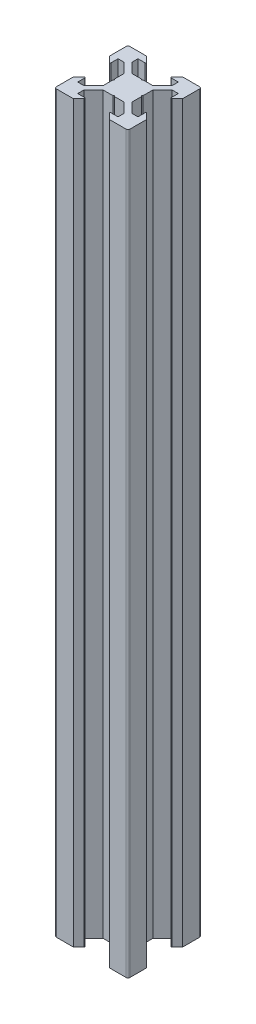
from build123d import *

# Parameters (mm, degrees)
BOSS_EXTRUDE1_DEPTH = 200


with BuildPart() as part:
    # Sketch1 → Boss-Extrude1 (new body)
    with BuildSketch(Plane(origin=(0, 0, 0), x_dir=(1, 0, 0), z_dir=(0, 1, 0))):
        with BuildLine():
            Line((-0.266657426, -3.932437418), (-0.066657426, -3.732437418))
            Line((-0.066657426, -3.732437418), (0.133342575, -3.932437418))
            Line((0.133342575, -3.932437418), (2.773342575, -3.932437418))
            Line((2.773342575, -3.932437418), (5.422682403, -6.581777247))
            Line((5.422682403, -6.581777247), (5.422682403, -8.231777247))
            Line((5.422682403, -8.231777247), (3.516185287, -8.231777247))
            ThreePointArc((3.516185287, -8.231777247), (3.331409381, -8.35524056), (3.37476393, -8.573198602))
            Line((3.37476393, -8.573198602), (4.833342574, -10.031777246))
            Line((4.833342574, -10.031777246), (9.433342574, -10.031777246))
            ThreePointArc((9.433342574, -10.031777246), (9.786895965, -9.885330637), (9.933342574, -9.531777246))
            Line((9.933342574, -9.531777246), (9.933342574, -4.931777246))
            Line((9.933342574, -4.931777246), (8.474763931, -3.473198602))
            ThreePointArc((8.474763931, -3.473198602), (8.256805888, -3.429844053), (8.133342575, -3.614619959))
            Line((8.133342575, -3.614619959), (8.133342575, -5.521117075))
            Line((8.133342575, -5.521117075), (6.483342575, -5.521117075))
            Line((6.483342575, -5.521117075), (3.834002746, -2.871777247))
            Line((3.834002746, -2.871777247), (3.834002746, -0.231777247))
            Line((3.834002746, -0.231777247), (3.634002746, -0.031777246))
            Line((3.634002746, -0.031777246), (3.834002746, 0.168222754))
            Line((3.834002746, 0.168222754), (3.834002746, 2.808222754))
            Line((3.834002746, 2.808222754), (6.483342575, 5.457562582))
            Line((6.483342575, 5.457562582), (8.133342575, 5.457562582))
            Line((8.133342575, 5.457562582), (8.133342575, 3.551065466))
            ThreePointArc((8.133342575, 3.551065466), (8.256805888, 3.36628956), (8.474763931, 3.40964411))
            Line((8.474763931, 3.40964411), (9.933342575, 4.868222753))
            Line((9.933342575, 4.868222753), (9.933342575, 9.468222753))
            ThreePointArc((9.933342575, 9.468222753), (9.786895965, 9.821776143), (9.433342575, 9.968222753))
            Line((9.433342575, 9.968222753), (4.833342575, 9.968222753))
            Line((4.833342575, 9.968222753), (3.374763931, 8.50964411))
            ThreePointArc((3.374763931, 8.50964411), (3.331409381, 8.291686067), (3.516185287, 8.168222754))
            Line((3.516185287, 8.168222754), (5.422682403, 8.168222754))
            Line((5.422682403, 8.168222754), (5.422682403, 6.518222754))
            Line((5.422682403, 6.518222754), (2.773342575, 3.868882925))
            Line((2.773342575, 3.868882925), (0.133342575, 3.868882925))
            Line((0.133342575, 3.868882925), (-0.066657426, 3.668882925))
            Line((-0.066657426, 3.668882925), (-0.266657426, 3.868882925))
            Line((-0.266657426, 3.868882925), (-2.906657426, 3.868882925))
            Line((-2.906657426, 3.868882925), (-5.555997254, 6.518222754))
            Line((-5.555997254, 6.518222754), (-5.555997254, 8.168222754))
            Line((-5.555997254, 8.168222754), (-3.649500138, 8.168222754))
            ThreePointArc((-3.649500138, 8.168222754), (-3.464724232, 8.291686067), (-3.508078782, 8.50964411))
            Line((-3.508078782, 8.50964411), (-4.966657426, 9.968222754))
            Line((-4.966657426, 9.968222754), (-9.566657426, 9.968222754))
            ThreePointArc((-9.566657426, 9.968222754), (-9.920210817, 9.821776144), (-10.066657426, 9.468222753))
            Line((-10.066657426, 9.468222753), (-10.066657426, 4.868222753))
            Line((-10.066657426, 4.868222753), (-8.608078782, 3.40964411))
            ThreePointArc((-8.608078782, 3.40964411), (-8.39012074, 3.366289559), (-8.266657426, 3.551065466))
            Line((-8.266657426, 3.551065466), (-8.266657426, 5.457562582))
            Line((-8.266657426, 5.457562582), (-6.616657426, 5.457562582))
            Line((-6.616657426, 5.457562582), (-3.967317598, 2.808222753))
            Line((-3.967317598, 2.808222753), (-3.967317598, 0.168222753))
            Line((-3.967317598, 0.168222753), (-3.767317597, -0.031777246))
            Line((-3.767317597, -0.031777246), (-3.967317598, -0.231777246))
            Line((-3.967317598, -0.231777246), (-3.967317598, -2.871777246))
            Line((-3.967317598, -2.871777246), (-6.616657426, -5.521117075))
            Line((-6.616657426, -5.521117075), (-8.266657426, -5.521117075))
            Line((-8.266657426, -5.521117075), (-8.266657426, -3.614619959))
            ThreePointArc((-8.266657426, -3.614619959), (-8.39012074, -3.429844052), (-8.608078782, -3.473198603))
            Line((-8.608078782, -3.473198603), (-10.066657426, -4.931777246))
            Line((-10.066657426, -4.931777246), (-10.066657426, -9.531777246))
            ThreePointArc((-10.066657426, -9.531777246), (-9.920210817, -9.885330637), (-9.566657426, -10.031777246))
            Line((-9.566657426, -10.031777246), (-4.966657426, -10.031777246))
            Line((-4.966657426, -10.031777246), (-3.508078782, -8.573198603))
            ThreePointArc((-3.508078782, -8.573198603), (-3.464724232, -8.35524056), (-3.649500138, -8.231777246))
            Line((-3.649500138, -8.231777246), (-5.555997254, -8.231777246))
            Line((-5.555997254, -8.231777246), (-5.555997254, -6.581777246))
            Line((-5.555997254, -6.581777246), (-2.906657426, -3.932437418))
            Line((-2.906657426, -3.932437418), (-0.266657426, -3.932437418))
        make_face()
    extrude(amount=BOSS_EXTRUDE1_DEPTH)


solid = part.part
